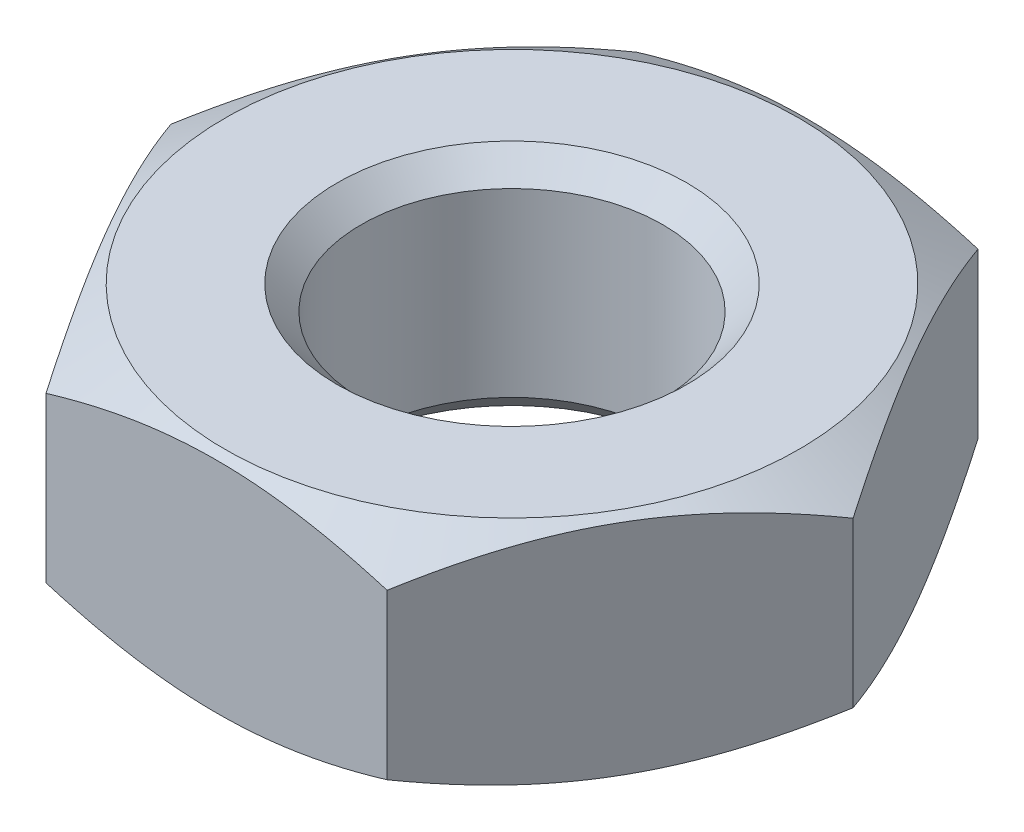
from build123d import *

# Parameters (mm, degrees)
BOSS_EXTRUDE1_DEPTH = 1.9
SKETCH2_R           = 1.25
CUT_EXTRUDE1_DEPTH  = 5.19712203
CHAMFER1_SIZE       = 0.2


with BuildPart() as part:
    # Sketch1 → Boss-Extrude1 (new body)
    with BuildSketch(Plane(origin=(0, 0, 0), x_dir=(1, 0, 0), z_dir=(0, 1, 0))):
        Polygon((1.41450816, 2.45), (-1.41450816, 2.45), (-2.829016319, 0), (-1.41450816, -2.45), (1.41450816, -2.45), (2.829016319, 0), align=None)
    extrude(amount=BOSS_EXTRUDE1_DEPTH)

    # Sketch2 → Cut-Extrude1 (cut, through all)
    with BuildSketch(Plane(origin=(0, 1.9, 0), x_dir=(1, 0, 0), z_dir=(0, 1, 0))):
        with Locations(Location((0, 0, 0), (0, 0, 270))):
            Circle(SKETCH2_R)
    extrude(amount=-CUT_EXTRUDE1_DEPTH, mode=Mode.SUBTRACT)

    # Chamfer1
    chamfer1_edges = [part.edges().sort_by_distance(p)[0] for p in [
        (0, 0, -1.25),
        (0, 1.9, -1.25),
    ]]
    chamfer(chamfer1_edges, length=CHAMFER1_SIZE)

    # Sketch3 → Cut-Revolve1 (revolve, cut)
    with BuildSketch(Plane(origin=(0, 0, 0), x_dir=(0, 0, -1), z_dir=(1, 0, 0)), mode=Mode.PRIVATE) as cut_revolve1_sk:
        Polygon((-2.88, 1.9), (-2.38, 1.9), (-2.88, 1.6), align=None)
        Polygon((-2.88, 0.3), (-2.88, 0), (-2.38, 0), align=None)
    revolve(cut_revolve1_sk.sketch.rotate(Axis((0, 0, 0), (0, 1, 0)), 180), axis=Axis((0, 0, 0), (0, 1, 0)), mode=Mode.SUBTRACT)


solid = part.part
